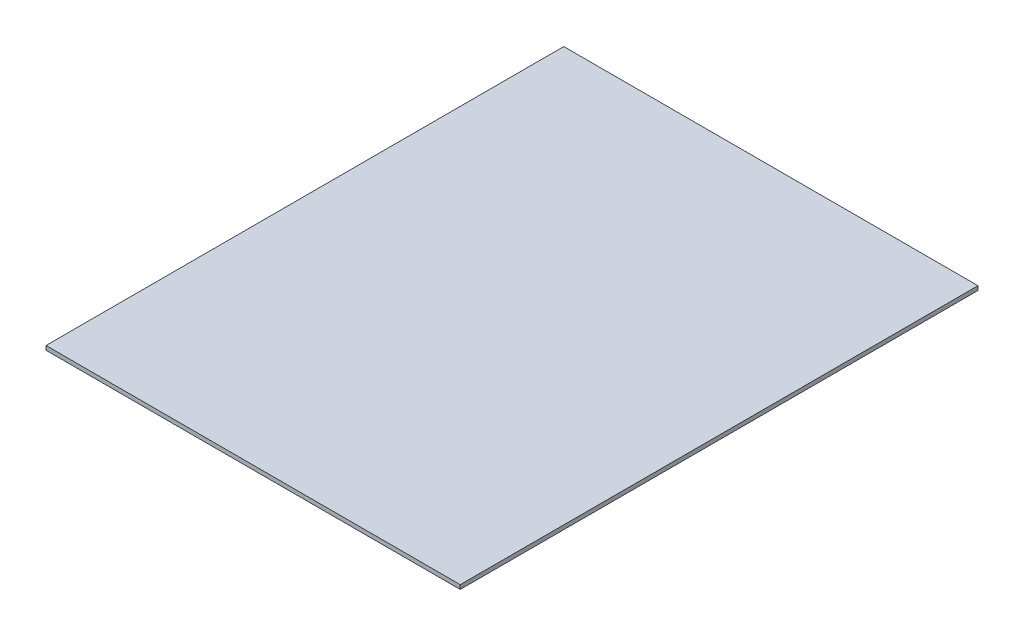
from build123d import *

# Parameters (mm, degrees)
OVEN_OMAKE_HAZNE_2_TEPSI_DUZLEMI_145_1_START = -60
SKETCH1_W                                    = 400
SKETCH1_H                                    = 4
OVEN_OMAKE_HAZNE_2_TEPSI_DUZLEMI_145_1_DEPTH = 500


with BuildPart() as part:
    # Sketch1 → OVEN_OMAKE_hazne_2_tepsi_duzlemi_145_1 (new body)
    with BuildSketch(Plane.XY.offset(OVEN_OMAKE_HAZNE_2_TEPSI_DUZLEMI_145_1_START)):
        with Locations((350, 1448)):
            Rectangle(SKETCH1_W, SKETCH1_H)
    extrude(amount=-OVEN_OMAKE_HAZNE_2_TEPSI_DUZLEMI_145_1_DEPTH)


solid = part.part
